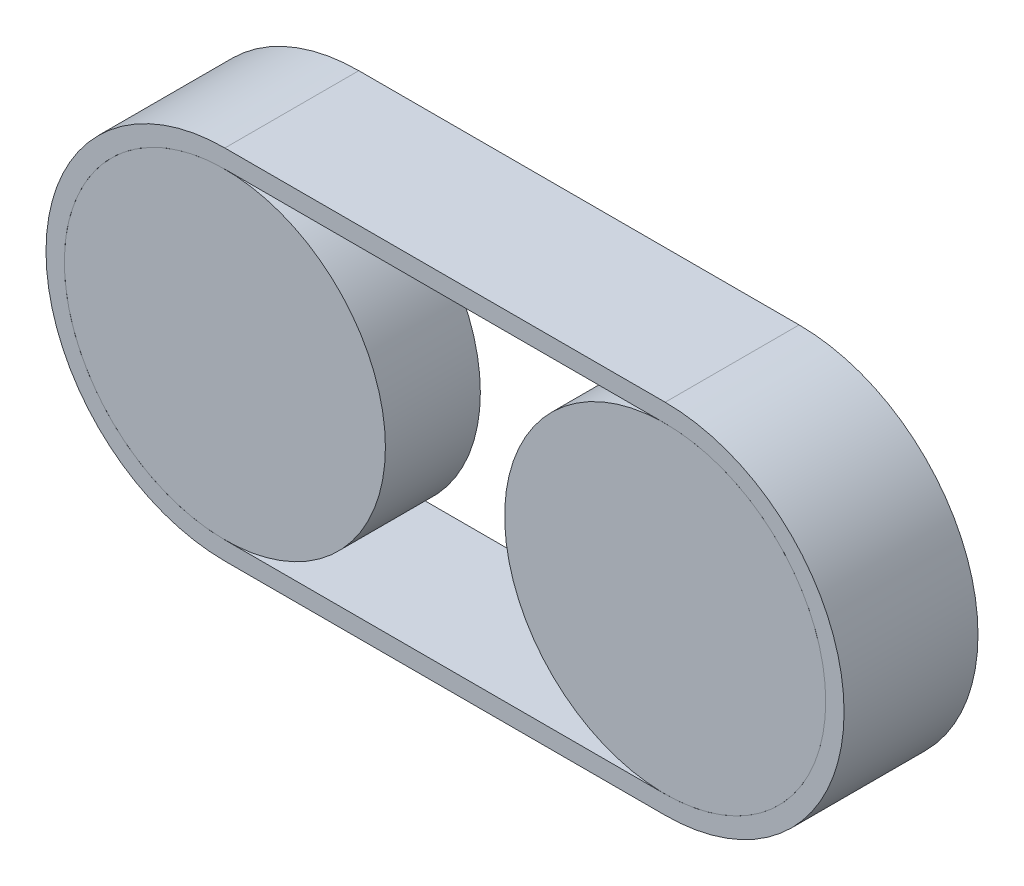
from build123d import *

# Parameters (mm, degrees)
BOSS_EXTRUDE1_DEPTH   = 14.6
SKETCH2_R             = 17.5
BOSS_EXTRUDE2_DEPTH   = 10.35
BOSS_EXTRUDE2_2_DEPTH = 10.35


with BuildPart() as part:
    # Sketch1 → Boss-Extrude1 (new body)
    with BuildSketch(Plane.XY):
        with BuildLine():
            Line((-24, 19.5), (24, 19.5))
            ThreePointArc((24, 19.5), (43.5, 0), (24, -19.5))
            Line((24, -19.5), (-24, -19.5))
            ThreePointArc((-24, -19.5), (-43.5, 0), (-24, 19.5))
        make_face()
        with BuildLine():
            Line((24, 17.5), (-24, 17.5))
            ThreePointArc((-24, 17.5), (-41.5, 0), (-24, -17.5))
            Line((-24, -17.5), (24, -17.5))
            ThreePointArc((24, -17.5), (41.5, 0), (24, 17.5))
        make_face(mode=Mode.SUBTRACT)
    extrude(amount=BOSS_EXTRUDE1_DEPTH)


with BuildPart() as body_2:
    # Sketch2 → Boss-Extrude2 (new body)
    with BuildSketch(Plane.XY.offset(14.6)):
        with Locations((-24, 0)):
            Circle(SKETCH2_R)
    extrude(amount=-BOSS_EXTRUDE2_DEPTH)


with BuildPart() as body_3:
    # Sketch2 → Boss-Extrude2 2 (new body)
    with BuildSketch(Plane.XY.offset(14.6)):
        with Locations((24, 0)):
            Circle(SKETCH2_R)
    extrude(amount=-BOSS_EXTRUDE2_2_DEPTH)


solid = Compound([part.part, body_2.part, body_3.part])
